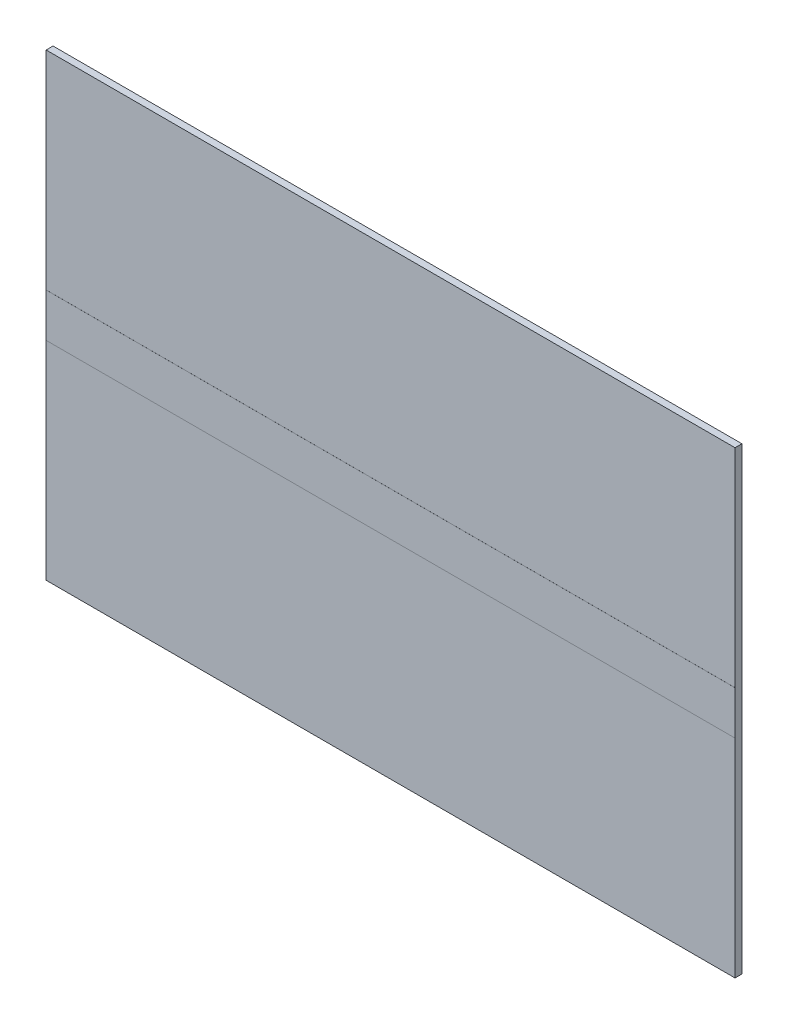
from build123d import *

# Parameters (mm, degrees)
SZKIC1_W                    = 300
SZKIC1_H                    = 200
DODANIE_WYCI_GNI_CIE1_DEPTH = 3
SZKIC2_W                    = 300
SZKIC2_H                    = 19
DODANIE_WYCI_GNI_CIE2_DEPTH = 0.02


with BuildPart() as part:
    # Szkic1 → Dodanie-wyciągnięcie1 (new body)
    with BuildSketch(Plane.XY):
        with Locations((150, 100)):
            Rectangle(SZKIC1_W, SZKIC1_H)
    extrude(amount=DODANIE_WYCI_GNI_CIE1_DEPTH)

    # Szkic2 → Dodanie-wyciągnięcie2 (add)
    with BuildSketch(Plane.XY.offset(3)):
        with Locations((150, 100)):
            Rectangle(SZKIC2_W, SZKIC2_H)
    extrude(amount=DODANIE_WYCI_GNI_CIE2_DEPTH)


solid = part.part
